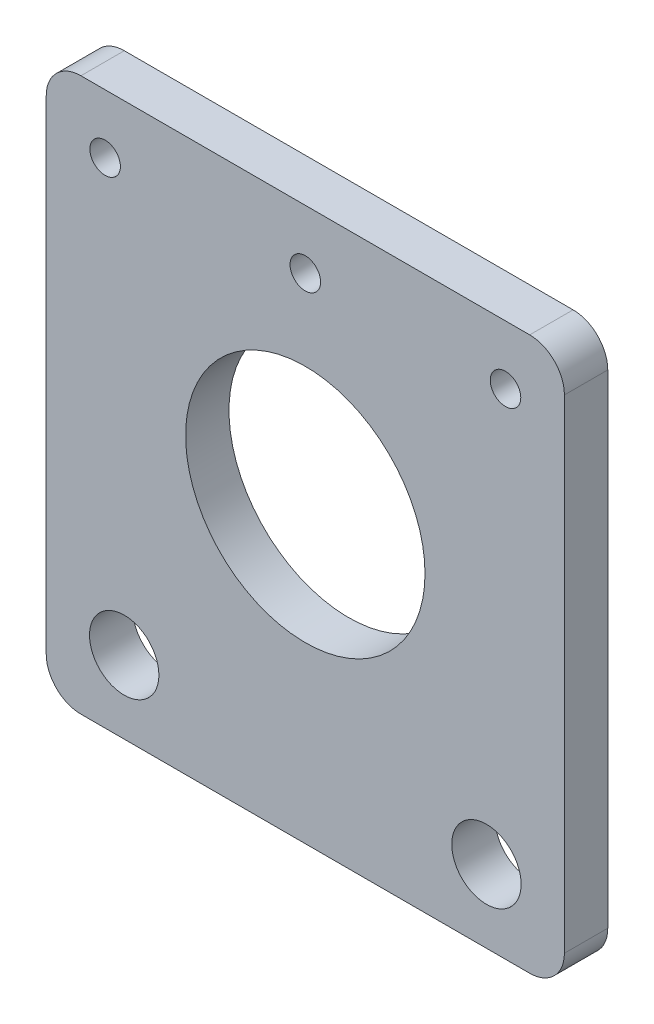
from build123d import *

# Parameters (mm, degrees)
SKETCH1_W           = 37.9349
SKETCH1_H           = 37.9349
BOSS_EXTRUDE1_DEPTH = 3.175
SKETCH9_R           = 1.1176
SKETCH9_R_2         = 2.54
SKETCH9_R_3         = 8.763
CUT_EXTRUDE2_DEPTH  = 3.175
SKETCH11_W          = 37.9349
SKETCH11_H          = 3.175
BOSS_EXTRUDE2_DEPTH = 2.54
FILLET1_R           = 2.54


with BuildPart() as part:
    # Sketch1 → Boss-Extrude1 (new body)
    with BuildSketch(Plane.XY):
        with Locations((18.96745, 18.96745)):
            Rectangle(SKETCH1_W, SKETCH1_H)
    extrude(amount=BOSS_EXTRUDE1_DEPTH)

    # Sketch9 → Cut-Extrude2 (cut)
    with BuildSketch(Plane.XY.offset(3.175)):
        with Locations((33.62325, 33.62325)):
            Circle(SKETCH9_R)
        with Locations((4.31165, 33.62325)):
            Circle(SKETCH9_R)
        with Locations((5.70865, 2.78765)):
            Circle(SKETCH9_R_2)
        with Locations((32.22625, 2.78765)):
            Circle(SKETCH9_R_2)
        with Locations((18.96745, 33.62325)):
            Circle(SKETCH9_R)
        with Locations((18.96745, 18.96745)):
            Circle(SKETCH9_R_3)
    extrude(amount=-CUT_EXTRUDE2_DEPTH, mode=Mode.SUBTRACT)

    # Sketch11 → Boss-Extrude2 (add)
    with BuildSketch(Plane.XZ):
        with Locations((18.96745, 1.5875)):
            Rectangle(SKETCH11_W, SKETCH11_H)
    extrude(amount=BOSS_EXTRUDE2_DEPTH)

    # Fillet1
    fillet1_edges = [part.edges().sort_by_distance(p)[0] for p in [
        (0, -2.54, 1.5875),
        (37.9349, -2.54, 1.5875),
        (0, 37.9349, 1.5875),
        (37.9349, 37.9349, 1.5875),
    ]]
    fillet(fillet1_edges, radius=FILLET1_R)


solid = part.part
